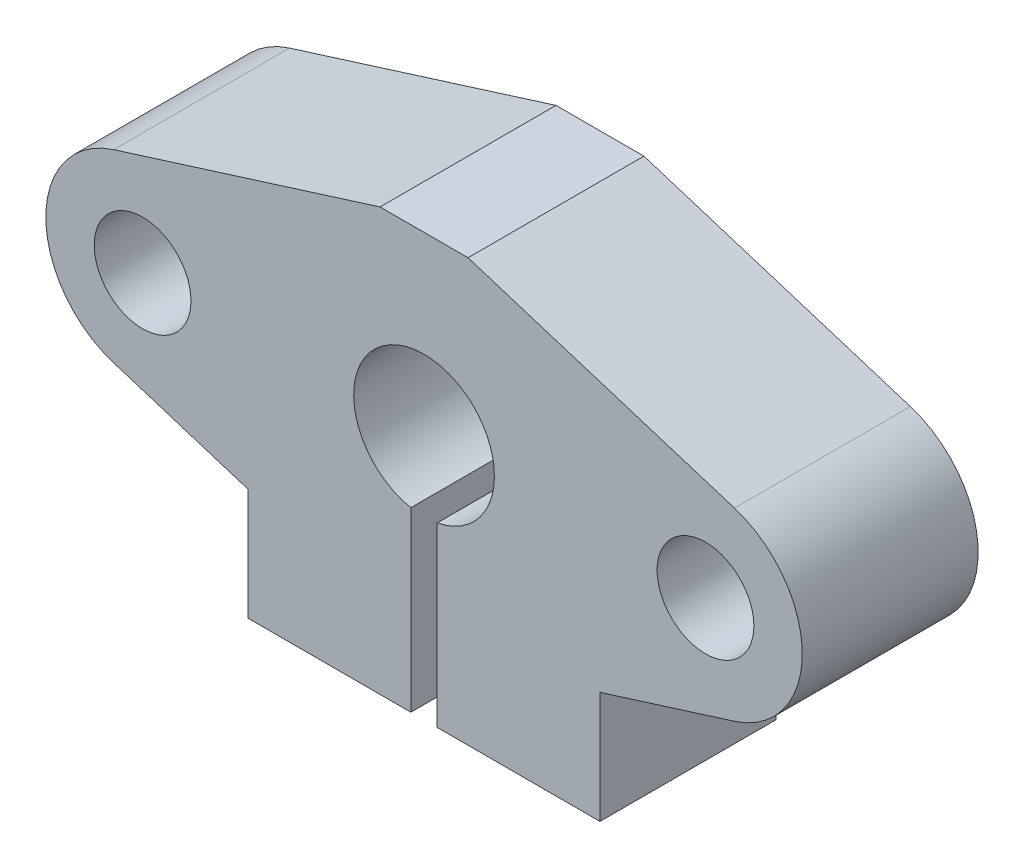
from build123d import *

# Parameters (mm, degrees)
EXTRUDE_1_DEPTH     = 10
SKETCH_2_W          = 20
SKETCH_2_H          = 14
EXTRUDE_2_DEPTH     = 10
CUT_EXTRUDE_1_REACH = 29.536
SKETCH_3_R          = 4
SKETCH_3_R_2        = 2.75
CUT_EXTRUDE_2_REACH = 29.536
SKETCH_4_W          = 1.5
SKETCH_4_H          = 14


with BuildPart() as part:
    # 草图1 → 凸台-拉伸1 (new body)
    with BuildSketch(Plane.XY):
        with BuildLine():
            Line((-17.646494004, -5.247766906), (-2.5, -10))
            Line((-2.5, -10), (2.5, -10))
            Line((2.5, -10), (17.646494004, -5.247766906))
            ThreePointArc((17.646494004, -5.247766906), (21.5, 0), (17.646494004, 5.247766906))
            Line((17.646494004, 5.247766906), (2.5, 10))
            Line((2.5, 10), (-2.5, 10))
            Line((-2.5, 10), (-17.646494004, 5.247766906))
            ThreePointArc((-17.646494004, 5.247766906), (-21.5, 0), (-17.646494004, -5.247766906))
        make_face()
    extrude(amount=EXTRUDE_1_DEPTH)

    # 草图2 → 凸台-拉伸2 (add)
    with BuildSketch(Plane.XY.offset(10)):
        with Locations((0, -7)):
            Rectangle(SKETCH_2_W, SKETCH_2_H)
    extrude(amount=-EXTRUDE_2_DEPTH)

    # 草图3 → 切除-拉伸1 (cut, up to next)
    with BuildSketch(Plane.XY.offset(10), mode=Mode.PRIVATE) as cut_extrude_1_sk1:
        Circle(SKETCH_3_R)
    cut_extrude_1_tool1 = extrude(cut_extrude_1_sk1.sketch, amount=-CUT_EXTRUDE_1_REACH, mode=Mode.PRIVATE) & part.part
    # 草图3 → 切除-拉伸1 (cut, up to next)
    with BuildSketch(Plane.XY.offset(10), mode=Mode.PRIVATE) as cut_extrude_1_sk2:
        with Locations((-16, 0)):
            Circle(SKETCH_3_R_2)
    cut_extrude_1_tool2 = extrude(cut_extrude_1_sk2.sketch, amount=-CUT_EXTRUDE_1_REACH, mode=Mode.PRIVATE) & part.part
    # 草图3 → 切除-拉伸1 (cut, up to next)
    with BuildSketch(Plane.XY.offset(10), mode=Mode.PRIVATE) as cut_extrude_1_sk3:
        with Locations((16, 0)):
            Circle(SKETCH_3_R_2)
    cut_extrude_1_tool3 = extrude(cut_extrude_1_sk3.sketch, amount=-CUT_EXTRUDE_1_REACH, mode=Mode.PRIVATE) & part.part
    add(cut_extrude_1_tool1.solids().sort_by_distance((0, 0, 10))[0], mode=Mode.SUBTRACT)
    add(cut_extrude_1_tool2.solids().sort_by_distance((-16, 0, 10))[0], mode=Mode.SUBTRACT)
    add(cut_extrude_1_tool3.solids().sort_by_distance((16, 0, 10))[0], mode=Mode.SUBTRACT)

    # 草图4 → 切除-拉伸2 (cut, up to next)
    with BuildSketch(Plane.XY.offset(10), mode=Mode.PRIVATE) as cut_extrude_2_sk1:
        with Locations((0, -7)):
            Rectangle(SKETCH_4_W, SKETCH_4_H)
    cut_extrude_2_tool1 = extrude(cut_extrude_2_sk1.sketch, amount=-CUT_EXTRUDE_2_REACH, mode=Mode.PRIVATE) & part.part
    add(cut_extrude_2_tool1.solids().sort_by_distance((0, -7, 10))[0], mode=Mode.SUBTRACT)


solid = part.part
